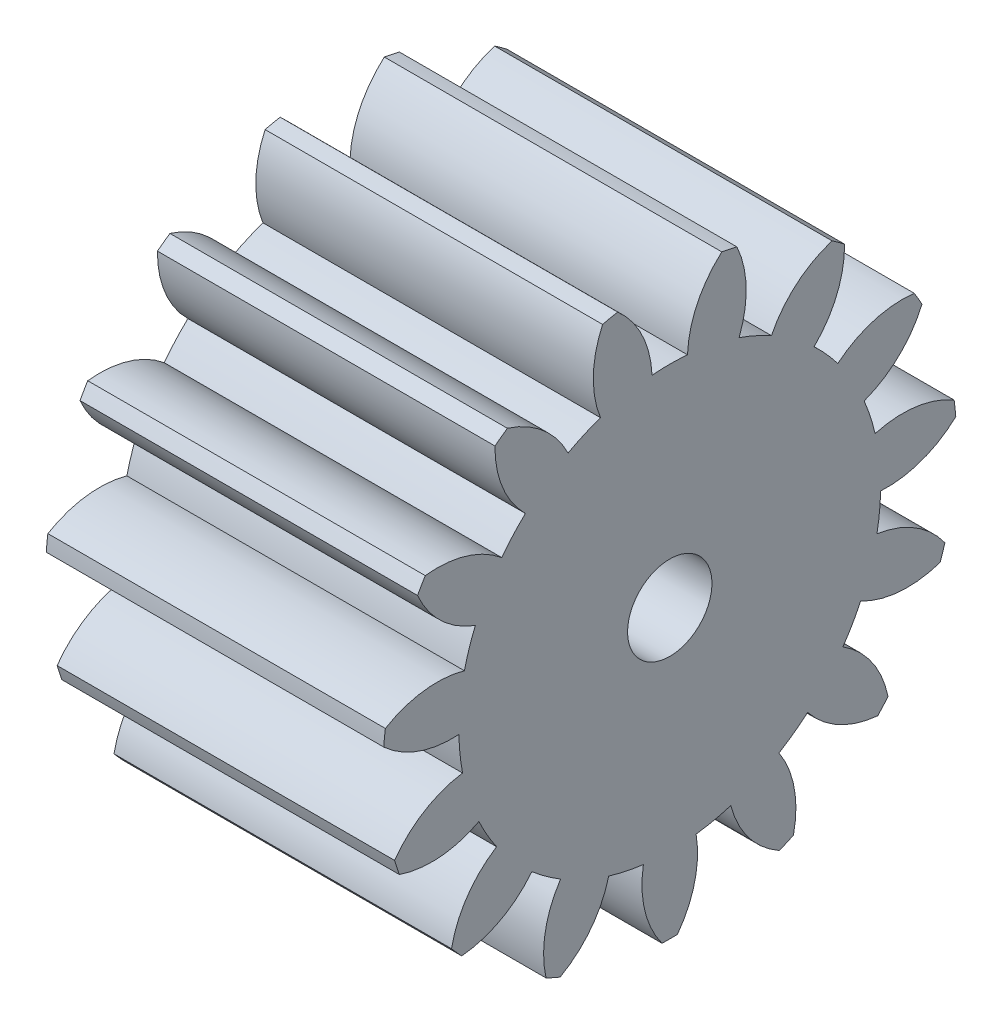
from build123d import *

# Parameters (mm, degrees)
BASPROSKE_W     = 20
BASPROSKE_H     = 17
TOOTHCUT_DEPTH  = 32.272991542
TEETHCUTS_COUNT = 15
TEETHCUTS_ANGLE = 336
BORSKE_R        = 2.5
BORE_DEPTH      = 50.0000508


with BuildPart() as part:
    # BasProSke → Base-Revolve (revolve)
    with BuildSketch(Plane(origin=(0, 0, 0), x_dir=(1, 0, 0), z_dir=(0, 1, 0)), mode=Mode.PRIVATE) as base_revolve_sk:
        with Locations((10, 8.5)):
            Rectangle(BASPROSKE_W, BASPROSKE_H)
    revolve(base_revolve_sk.sketch.rotate(Axis((-10, 0, 0), (1, 0, 0)), 180), axis=Axis((-10, 0, 0), (1, 0, 0)))

    # TooCutSke → ToothCut (cut, through all)
    with BuildSketch(Plane(origin=(0, 0, 0), x_dir=(0, 0, -1), z_dir=(1, 0, 0))):
        with BuildLine():
            ThreePointArc((1.050056448, 12.454813626), (0, 12.499), (-1.050056448, 12.454813626))
            ThreePointArc((-1.050056448, 12.454813626), (-1.638118106, 14.809604533), (-3.110934279, 16.73876737))
            ThreePointArc((-3.110934279, 16.73876737), (0, 17.0254), (3.110934279, 16.73876737))
            ThreePointArc((3.110934279, 16.73876737), (1.638118106, 14.809604533), (1.050056448, 12.454813626))
        make_face()
    toothcut = extrude(amount=TOOTHCUT_DEPTH, mode=Mode.SUBTRACT)

    # TeethCuts: ToothCut ×15 about axis
    teethcuts_axis = Axis((-10, 0, 0), (1, 0, 0))
    for i in range(1, TEETHCUTS_COUNT):
        add(toothcut.rotate(teethcuts_axis, i * TEETHCUTS_ANGLE / (TEETHCUTS_COUNT - 1)), mode=Mode.SUBTRACT)

    # BorSke → Bore (cut, symmetric)
    with BuildSketch(Plane(origin=(0, 0, 0), x_dir=(0, 0, -1), z_dir=(1, 0, 0))):
        with Locations(Location((0, 0, 0), (0, 0, 180))):
            Circle(BORSKE_R)
    extrude(amount=BORE_DEPTH, both=True, mode=Mode.SUBTRACT)


solid = part.part
